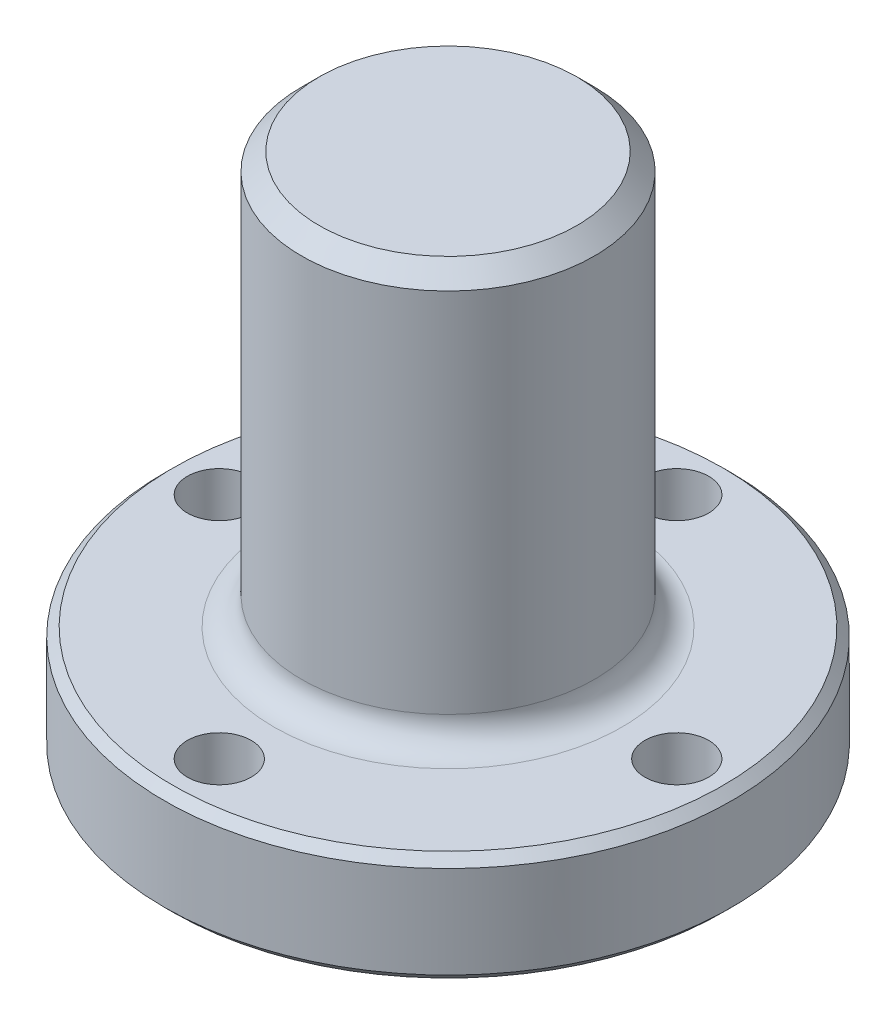
from build123d import *

# Parameters (mm, degrees)
CUT_EXTRUDE2_START = -20.2057
SKETCH2_R          = 2.7686
CUT_EXTRUDE2_DEPTH = 20.2057
FILLET1_R          = 2.3876
CHAMFER1_SIZE      = 0.762
CHAMFER2_SIZE      = 1.524


with BuildPart() as part:
    # Sketch1 → Revolve1 (revolve)
    with BuildSketch(Plane(origin=(0, 0, 0), x_dir=(0, 1, 0), z_dir=(0, 0, 1)), mode=Mode.PRIVATE) as revolve1_sk:
        Polygon((-25.0317, 0), (-25.0317, 8.7122), (-20.2057, 8.7122), (-20.2057, 24.6126), (-10.6807, 24.6126), (-10.6807, 12.7), (25.0317, 12.7), (25.0317, 0), align=None)
    revolve(revolve1_sk.sketch.rotate(Axis((0, -50.4317, 0), (0, 1, 0)), 270), axis=Axis((0, -50.4317, 0), (0, 1, 0)))

    # Sketch2 → Cut-Extrude2 (cut)
    with BuildSketch(Plane(origin=(0, 0, 0), x_dir=(-1, 0, 0), z_dir=(0, 1, 0)).offset(CUT_EXTRUDE2_START)):
        with Locations(Location((19.8374, 0, 0), (0, 0, 270))):
            Circle(SKETCH2_R)
        with Locations(Location((0, 19.8374, 0), (0, 0, 270))):
            Circle(SKETCH2_R)
        with Locations(Location((-19.8374, 0, 0), (0, 0, 270))):
            Circle(SKETCH2_R)
        with Locations(Location((0, -19.8374, 0), (0, 0, 270))):
            Circle(SKETCH2_R)
    extrude(amount=CUT_EXTRUDE2_DEPTH, mode=Mode.SUBTRACT)

    # Fillet1
    fillet1_edges = [part.edges().sort_by_distance(p)[0] for p in [
        (0, -10.6807, 12.7),
    ]]
    fillet(fillet1_edges, radius=FILLET1_R)

    # Chamfer1
    chamfer1_edges = [part.edges().sort_by_distance(p)[0] for p in [
        (0, -10.6807, 24.6126),
        (0, -20.2057, 24.6126),
    ]]
    chamfer(chamfer1_edges, length=CHAMFER1_SIZE)

    # Chamfer2
    chamfer2_edges = [part.edges().sort_by_distance(p)[0] for p in [
        (0, 25.0317, 12.7),
    ]]
    chamfer(chamfer2_edges, length=CHAMFER2_SIZE)


solid = part.part
